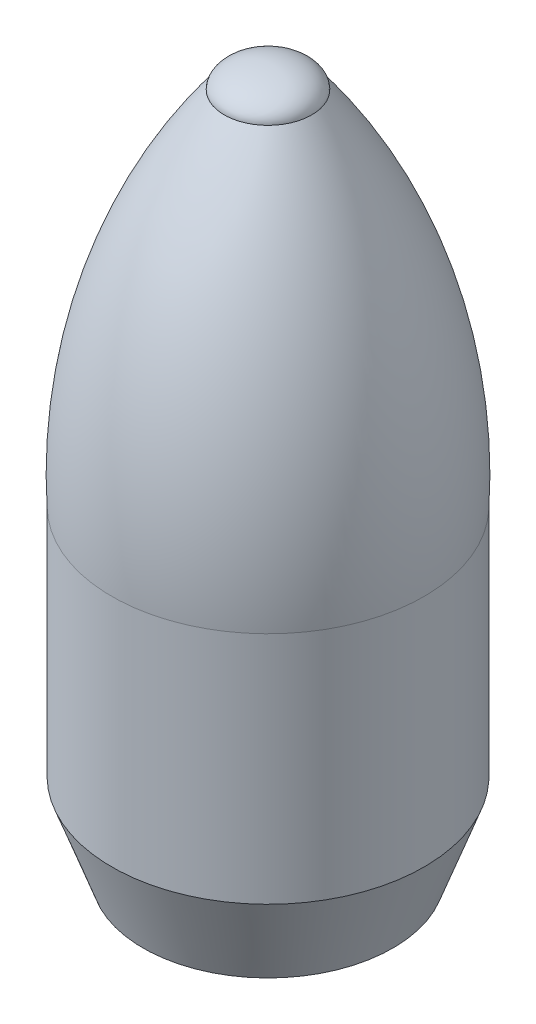
from build123d import *

# Parameters (mm, degrees)
DOME1_FACE_RADIUS = 700
DOME1_HEIGHT      = 350


with BuildPart() as part:
    # Sketch1 → Revolve2 (revolve)
    with BuildSketch(Plane.XY):
        with BuildLine():
            Line((0, 0), (2000, 0))
            Line((2000, 0), (2500, 1375))
            Line((2500, 1375), (2500, 5125))
            ThreePointArc((2500, 5125), (2114.996300216, 8173.01832734), (700, 10900))
            Line((700, 10900), (0, 10900))
            Line((0, 10900), (0, 0))
        make_face()
    revolve(axis=Axis((0, 0, 0), (0, 1, 0)))

    # Dome1: an elliptical dome of height H over a round flat face of radius A is half a spheroid: the quarter ellipse of half axes A and H revolved about the face's axis
    with BuildSketch(Plane((0, 10900, 0), x_dir=(0, 0, -1), z_dir=(1, 0, 0)), mode=Mode.PRIVATE) as dome1_quarter:
        Ellipse(DOME1_FACE_RADIUS, DOME1_HEIGHT)
        Rectangle(DOME1_FACE_RADIUS, DOME1_HEIGHT, align=(Align.MIN, Align.MIN), mode=Mode.INTERSECT)
    revolve(dome1_quarter.sketch, axis=Axis((0, 10900, 0), (0, 1, 0)))


solid = part.part
